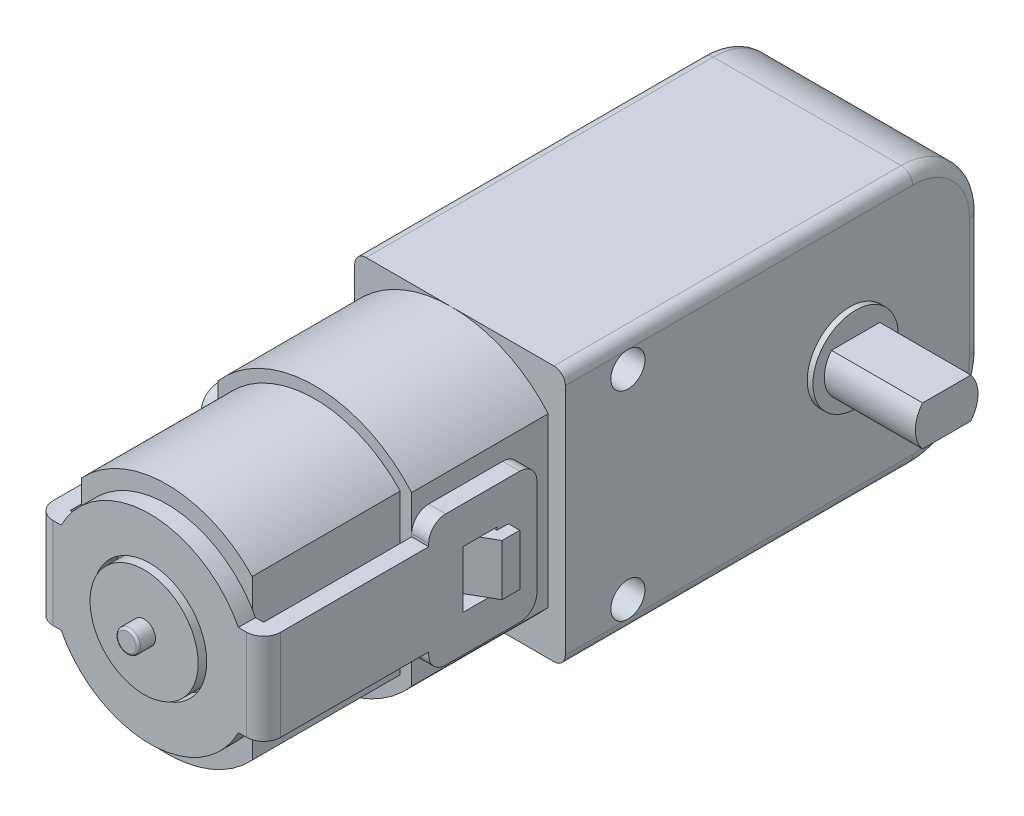
from build123d import *

# Parameters (mm, degrees)
ESBO_O1_W                 = 36.5
ESBO_O1_H                 = 22.5
RESSALTO_EXTRUS_O1_DEPTH  = 9.25
FILETE1_R                 = 6
RESSALTO_EXTRUS_O2_DEPTH  = 12
RESSALTO_EXTRUS_O3_DEPTH  = 13
ESBO_O4_R                 = 3.75
RESSALTO_EXTRUS_O4_DEPTH  = 0.5
ESBO_O5_W                 = 9.5
ESBO_O5_H                 = 11.5
RESSALTO_EXTRUS_O5_DEPTH  = 1.5
ESBO_O6_W                 = 1.5
ESBO_O6_H                 = 8
RESSALTO_EXTRUS_O6_DEPTH  = 13
ESBO_O8_R                 = 4.75
RESSALTO_EXTRUS_O7_DEPTH  = 2
ESBO_O7_R                 = 5
RESSALTO_EXTRUS_O8_DEPTH  = 1.5
ESBO_O10_W                = 1.5
ESBO_O10_H                = 8
RESSALTO_EXTRUS_O9_DEPTH  = 13
ESBO_O11_W                = 1.5
ESBO_O11_H                = 11.5
RESSALTO_EXTRUS_O10_DEPTH = 9.5
FILETE2_R                 = 1.5
ESBO_O12_W                = 3
ESBO_O12_H                = 5
CORTE_EXTRUS_O1_DEPTH     = 57.83803744
RESSALTO_EXTRUS_O11_DEPTH = 2.25
ESBO_O15_R                = 1
RESSALTO_EXTRUS_O12_DEPTH = 1.5
RESSALTO_EXTRUS_O13_DEPTH = 8
FILETE4_R                 = 1
ESBO_O17_R                = 1.5
CORTE_EXTRUS_O2_DEPTH     = 59.564601083
ESBO_O19_R                = 1.5
RESSALTO_EXTRUS_O14_DEPTH = 1.5
FILETE5_R                 = 1
FILETE6_R                 = 0.2


with BuildPart() as part:
    # Esboço1 → Ressalto-extrusão1 (new, symmetric)
    with BuildSketch(Plane(origin=(0, 0, 0), x_dir=(0, 0, -1), z_dir=(1, 0, 0))):
        with Locations((-6.75, 0)):
            Rectangle(ESBO_O1_W, ESBO_O1_H)
    extrude(amount=RESSALTO_EXTRUS_O1_DEPTH, both=True)

    # Filete1
    filete1_edges = [part.edges().sort_by_distance(p)[0] for p in [
        (0, -11.25, -11.5),
        (0, 11.25, -11.5),
    ]]
    fillet(filete1_edges, radius=FILETE1_R)

    # Esboço2 → Ressalto-extrusão2 (add)
    with BuildSketch(Plane.XY.offset(25)):
        with BuildLine():
            Line((7.75, 7.369701486), (7.75, -7.369701486))
            ThreePointArc((7.75, -7.369701486), (-0.75, -11.25), (-9.25, -7.369701486))
            Line((-9.25, -7.369701486), (-9.25, 7.369701486))
            ThreePointArc((-9.25, 7.369701486), (-0.75, 11.25), (7.75, 7.369701486))
        make_face()
    extrude(amount=RESSALTO_EXTRUS_O2_DEPTH)

    # Esboço3 → Ressalto-extrusão3 (add)
    with BuildSketch(Plane.XY.offset(37)):
        with BuildLine():
            Line((-8.25, 6.986594306), (-8.25, -6.986594306))
            ThreePointArc((-8.25, -6.986594306), (-0.75, -10.25), (6.75, -6.986594306))
            Line((6.75, -6.986594306), (6.75, 6.986594306))
            ThreePointArc((6.75, 6.986594306), (-0.75, 10.25), (-8.25, 6.986594306))
        make_face()
    extrude(amount=RESSALTO_EXTRUS_O3_DEPTH)

    # Esboço4 → Ressalto-extrusão4 (add)
    with BuildSketch(Plane(origin=(9.25, 0, 0), x_dir=(0, 0, -1), z_dir=(1, 0, 0))):
        with Locations(Location((0, 0, 0), (0, 0, 180))):
            Circle(ESBO_O4_R)
    extrude(amount=RESSALTO_EXTRUS_O4_DEPTH)

    # Esboço8 → Ressalto-extrusão7 (add)
    with BuildSketch(Plane.XY.offset(50)):
        with Locations((-0.75, 0)):
            Circle(ESBO_O8_R)
    extrude(amount=RESSALTO_EXTRUS_O7_DEPTH)

    # Esboço14 → Ressalto-extrusão11 (add, symmetric)
    with BuildSketch(Plane(origin=(0, 0, 0), x_dir=(1, 0, 0), z_dir=(0, 1, 0))):
        Polygon((7.75, -33), (10.25, -31.556624327), (10.25, -30), (9.25, -30), (9.25, -31), (7.75, -31), align=None)
    ressalto_extrus_o11 = extrude(amount=RESSALTO_EXTRUS_O11_DEPTH, both=True)

    # Espelhar6: Ressalto-extrusão11 across plane
    add(ressalto_extrus_o11.mirror(Plane(origin=(-0.75, 8.75, 51.5), x_dir=(0, 0, 1), z_dir=(-1, 0, 0))))

    # Esboço15 → Ressalto-extrusão12 (add)
    with BuildSketch(Plane.XY.offset(52)):
        with Locations((-0.75, 0)):
            Circle(ESBO_O15_R)
    extrude(amount=RESSALTO_EXTRUS_O12_DEPTH)

    # Esboço16 → Ressalto-extrusão13 (add)
    with BuildSketch(Plane(origin=(9.75, 0, 0), x_dir=(0, 0, -1), z_dir=(1, 0, 0))):
        with BuildLine():
            Line((-2.121320344, 1.75), (2.121320344, 1.75))
            ThreePointArc((2.121320344, 1.75), (2.75, 0), (2.121320344, -1.75))
            Line((2.121320344, -1.75), (-2.121320344, -1.75))
            ThreePointArc((-2.121320344, -1.75), (-2.75, 0), (-2.121320344, 1.75))
        make_face()
    extrude(amount=RESSALTO_EXTRUS_O13_DEPTH)

    # Filete4
    filete4_edges = [part.edges().sort_by_distance(p)[0] for p in [
        (-9.25, -11.25, 9.75),
        (9.25, -11.25, 9.75),
        (9.25, -9.492640687, -9.742640687),
        (-9.25, -9.492640687, -9.742640687),
        (9.25, 0, -11.5),
        (-9.25, 0, -11.5),
        (9.25, 9.492640687, -9.742640687),
        (-9.25, 9.492640687, -9.742640687),
        (9.25, 11.25, 9.75),
        (-9.25, 11.25, 9.75),
    ]]
    fillet(filete4_edges, radius=FILETE4_R)

    # Esboço17 → Corte-extrusão2 (cut, through all)
    with BuildSketch(Plane(origin=(9.25, 0, 0), x_dir=(0, 0, -1), z_dir=(1, 0, 0))):
        with Locations(Location((-19.5, 8.75, 0), (0, 0, 90))):
            Circle(ESBO_O17_R)
        with Locations(Location((-19.5, -8.75, 0), (0, 0, 270))):
            Circle(ESBO_O17_R)
    extrude(amount=-CORTE_EXTRUS_O2_DEPTH, mode=Mode.SUBTRACT)

    # Esboço19 → Ressalto-extrusão14 (add, symmetric)
    with BuildSketch(Plane(origin=(0, 0, 0), x_dir=(0, 0, -1), z_dir=(1, 0, 0))):
        with BuildLine():
            Line((11.5, 3), (14.450819672, 2.459016393))
            ThreePointArc((14.450819672, 2.459016393), (16.5, 0), (14.450819672, -2.459016393))
            Line((14.450819672, -2.459016393), (11.5, -3))
            Line((11.5, -3), (11.5, 3))
        make_face()
        with Locations((14, 0)):
            Circle(ESBO_O19_R, mode=Mode.SUBTRACT)
    extrude(amount=RESSALTO_EXTRUS_O14_DEPTH, both=True)

    # Filete5
    filete5_edges = [part.edges().sort_by_distance(p)[0] for p in [
        (0, 3, -11.5),
        (0, -3, -11.5),
    ]]
    fillet(filete5_edges, radius=FILETE5_R)

    # Filete6
    filete6_edges = [part.edges().sort_by_distance(p)[0] for p in [
        (-1.75, 0, 53.5),
    ]]
    fillet(filete6_edges, radius=FILETE6_R)


with BuildPart() as body_2:
    # Esboço5 → Ressalto-extrusão5 (new body)
    with BuildSketch(Plane(origin=(7.75, 0, 0), x_dir=(0, 0, -1), z_dir=(1, 0, 0))):
        with Locations((-32.25, 0)):
            Rectangle(ESBO_O5_W, ESBO_O5_H)
    extrude(amount=RESSALTO_EXTRUS_O5_DEPTH)

    # Esboço6 → Ressalto-extrusão6 (add)
    with BuildSketch(Plane.XY.offset(37)):
        with Locations((8.5, 0)):
            Rectangle(ESBO_O6_W, ESBO_O6_H)
    extrude(amount=RESSALTO_EXTRUS_O6_DEPTH)

    # Esboço7 → Ressalto-extrusão8 (add)
    with BuildSketch(Plane.XY.offset(50)):
        with BuildLine():
            Line((9.25, 4), (7.032191208, 4))
            ThreePointArc((7.032191208, 4), (-0.75, 8.75), (-8.532191208, 4))
            Line((-8.532191208, 4), (-10.75, 4))
            Line((-10.75, 4), (-10.75, -4))
            Line((-10.75, -4), (-8.532191208, -4))
            ThreePointArc((-8.532191208, -4), (-0.75, -8.75), (7.032191208, -4))
            Line((7.032191208, -4), (9.25, -4))
            Line((9.25, -4), (9.25, 4))
        make_face()
        with Locations((-0.75, 0)):
            Circle(ESBO_O7_R, mode=Mode.SUBTRACT)
    extrude(amount=RESSALTO_EXTRUS_O8_DEPTH)

    # Esboço10 → Ressalto-extrusão9 (add)
    with BuildSketch(Plane(origin=(0, 0, 50), x_dir=(-1, 0, 0), z_dir=(0, 0, -1))):
        with Locations((10, 0)):
            Rectangle(ESBO_O10_W, ESBO_O10_H)
    extrude(amount=RESSALTO_EXTRUS_O9_DEPTH)

    # Esboço11 → Ressalto-extrusão10 (add)
    with BuildSketch(Plane(origin=(0, 0, 37), x_dir=(-1, 0, 0), z_dir=(0, 0, -1))):
        with Locations((10, 0)):
            Rectangle(ESBO_O11_W, ESBO_O11_H)
    extrude(amount=RESSALTO_EXTRUS_O10_DEPTH)

    # Filete2
    filete2_edges = [body_2.edges().sort_by_distance(p)[0] for p in [
        (8.5, -5.75, 37),
        (8.5, -5.75, 27.5),
        (8.5, 5.75, 27.5),
        (8.5, 5.75, 37),
        (9.25, 0, 51.5),
        (-10.75, 0, 51.5),
        (-10, -5.75, 27.5),
        (-10, -5.75, 37),
        (-10, 5.75, 37),
        (-10, 5.75, 27.5),
    ]]
    fillet(filete2_edges, radius=FILETE2_R)

    # Esboço12 → Corte-extrusão1 (cut, through all)
    with BuildSketch(Plane(origin=(9.25, 0, 0), x_dir=(0, 0, -1), z_dir=(1, 0, 0))):
        with Locations((-32.5, 0)):
            Rectangle(ESBO_O12_W, ESBO_O12_H)
    extrude(amount=-CORTE_EXTRUS_O1_DEPTH, mode=Mode.SUBTRACT)


solid = Compound([part.part, body_2.part])
